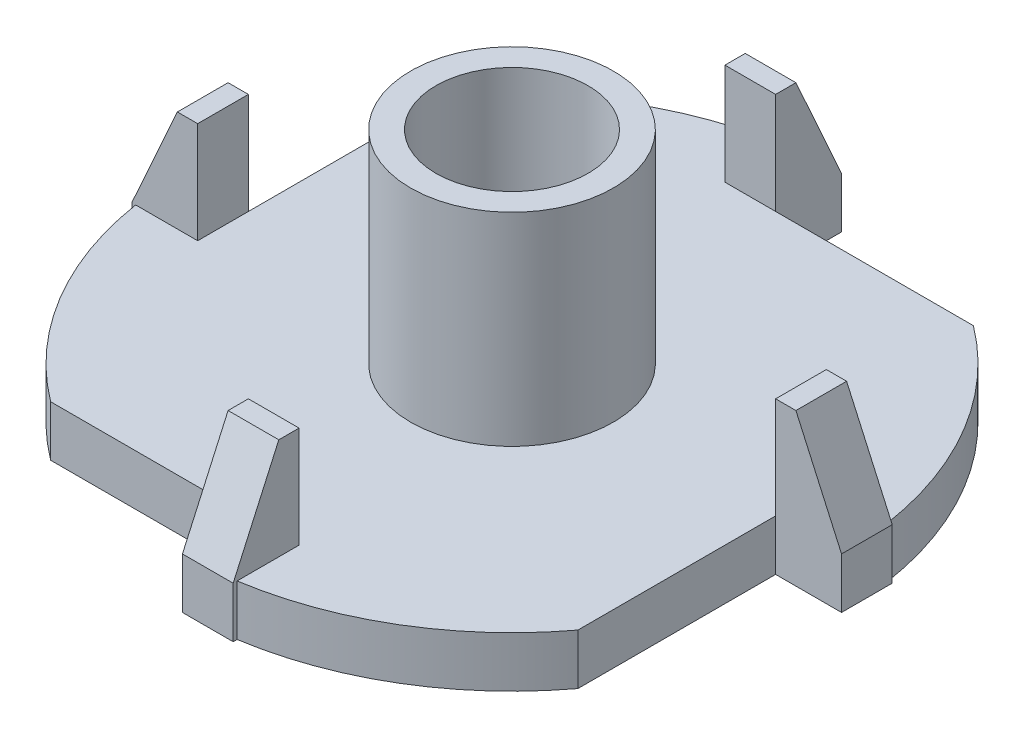
from build123d import *

# Parameters (mm, degrees)
SKETCH1_R           = 1.5
BOSS_EXTRUDE1_DEPTH = 1
BOSS_EXTRUDE2_DEPTH = 1
CIRPATTERN1_COUNT   = 4
SKETCH4_R           = 2
SKETCH4_R_2         = 1.5
BOSS_EXTRUDE3_DEPTH = 4


with BuildPart() as part:
    # Sketch1 → Boss-Extrude1 (new body)
    with BuildSketch(Plane(origin=(0, 0, 0), x_dir=(1, 0, 0), z_dir=(0, 1, 0))):
        with BuildLine():
            Line((-5.2, 3.9), (-5.2, 0))
            Line((-5.2, 0), (-6.5, 0))
            Line((-6.5, 0), (-6.5, -1))
            Line((-6.5, -1), (-6.422616289, -1))
            ThreePointArc((-6.422616289, -1), (-5.572172087, -3.346774303), (-3.9, -5.2))
            Line((-3.9, -5.2), (0, -5.2))
            Line((0, -5.2), (0, -6.5))
            Line((0, -6.5), (1, -6.5))
            Line((1, -6.5), (1, -6.422616289))
            ThreePointArc((1, -6.422616289), (3.346774303, -5.572172087), (5.2, -3.9))
            Line((5.2, -3.9), (5.2, 0))
            Line((5.2, 0), (6.5, 0))
            Line((6.5, 0), (6.5, 1))
            Line((6.5, 1), (6.422616289, 1))
            ThreePointArc((6.422616289, 1), (5.572172087, 3.346774303), (3.9, 5.2))
            Line((3.9, 5.2), (0, 5.2))
            Line((0, 5.2), (0, 6.5))
            Line((0, 6.5), (-1, 6.5))
            Line((-1, 6.5), (-1, 6.422616289))
            ThreePointArc((-1, 6.422616289), (-3.346774303, 5.572172087), (-5.2, 3.9))
        make_face()
        with Locations(Location((0, 0, 0), (0, 0, 270))):
            Circle(SKETCH1_R, mode=Mode.SUBTRACT)
    extrude(amount=BOSS_EXTRUDE1_DEPTH)

    # Sketch3 → Boss-Extrude2 (add)
    with BuildSketch(Plane.ZY):
        Polygon((5.2, 1), (5.2, 3), (5.6, 3), (6.5, 1), align=None)
    boss_extrude2 = extrude(amount=-BOSS_EXTRUDE2_DEPTH)

    # CirPattern1: Boss-Extrude2 ×4 about axis
    cirpattern1_axis = Axis((0, 0, 0), (0, 1, 0))
    for i in range(1, CIRPATTERN1_COUNT):
        add(boss_extrude2.rotate(cirpattern1_axis, i * 360 / CIRPATTERN1_COUNT))

    # Sketch4 → Boss-Extrude3 (add)
    with BuildSketch(Plane(origin=(0, 1, 0), x_dir=(1, 0, 0), z_dir=(0, 1, 0))):
        with Locations(Location((0, 0, 0), (0, 0, 270))):
            Circle(SKETCH4_R)
        with Locations(Location((0, 0, 0), (0, 0, 270))):
            Circle(SKETCH4_R_2, mode=Mode.SUBTRACT)
    extrude(amount=BOSS_EXTRUDE3_DEPTH)


solid = part.part
